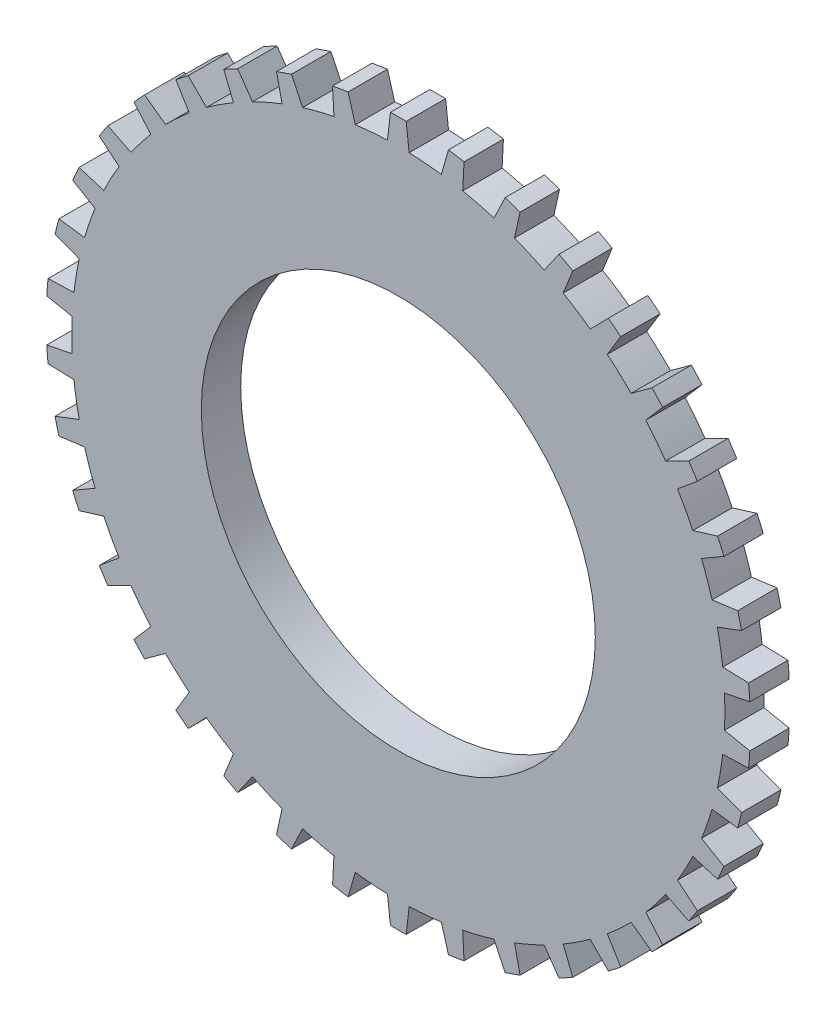
from build123d import *

# Parameters (mm, degrees)
CROQUIS1_R              = 10
SALIENTE_EXTRUIR1_DEPTH = 2


with BuildPart() as part:
    # Croquis1 → Saliente-Extruir1 (new body)
    with BuildSketch(Plane.XY):
        with BuildLine():
            Line((-0.4, 17.872007855), (-0.55, 16.567356684))
            ThreePointArc((-0.55, 16.567356684), (-1.368875163, 16.519866473), (-2.184398569, 16.431926557))
            Line((-2.184398569, 16.431926557), (-2.547091289, 17.694094798))
            Line((-2.547091289, 17.694094798), (-3.336180332, 17.562419126))
            Line((-3.336180332, 17.562419126), (-3.269396002, 16.250872508))
            ThreePointArc((-3.269396002, 16.250872508), (-4.069286144, 16.069247579), (-4.859212438, 15.848276309))
            Line((-4.859212438, 15.848276309), (-5.424704567, 17.033532961))
            Line((-5.424704567, 17.033532961), (-6.181358361, 16.773773385))
            Line((-6.181358361, 16.773773385), (-5.899611404, 15.491106893))
            ThreePointArc((-5.899611404, 15.491106893), (-6.658697606, 15.180301502), (-7.40147966, 14.832326396))
            Line((-7.40147966, 14.832326396), (-8.154346046, 15.908340747))
            ThreePointArc((-8.154346046, 15.908340747), (-8.508265751, 15.721898062), (-8.857925047, 15.527582833))
            Line((-8.857925047, 15.527582833), (-8.368900786, 14.308784264))
            ThreePointArc((-8.368900786, 14.308784264), (-9.066477156, 13.877276371), (-9.741853811, 13.411789285))
            Line((-9.741853811, 13.411789285), (-10.661558222, 14.349210468))
            ThreePointArc((-10.661558222, 14.349210468), (-10.979963466, 14.107057349), (-11.29287063, 13.857840297))
            Line((-11.29287063, 13.857840297), (-10.609908371, 12.736155301))
            ThreePointArc((-10.609908371, 12.736155301), (-11.226946843, 12.195715316), (-11.816495585, 11.625413523))
            Line((-11.816495585, 11.625413523), (-12.877950882, 12.398671132))
            ThreePointArc((-12.877950882, 12.398671132), (-13.1521564, 12.107412886), (-13.419776139, 11.810092004))
            Line((-13.419776139, 11.810092004), (-12.561505313, 10.816117222))
            ThreePointArc((-12.561505313, 10.816117222), (-13.081174687, 10.181486939), (-13.568814162, 9.521926786))
            Line((-13.568814162, 9.521926786), (-14.743066612, 10.109928369))
            ThreePointArc((-14.743066612, 10.109928369), (-14.965592793, 9.777509761), (-15.180625139, 9.440195187))
            Line((-15.180625139, 9.440195187), (-14.170457136, 8.60104366))
            ThreePointArc((-14.170457136, 8.60104366), (-14.578582186, 7.88953414), (-14.951010861, 7.158706708))
            Line((-14.951010861, 7.158706708), (-16.206029917, 7.545413115))
            ThreePointArc((-16.206029917, 7.545413115), (-16.370806826, 7.180901658), (-16.527386257, 6.812794454))
            Line((-16.527386257, 6.812794454), (-15.392875828, 6.151356049))
            ThreePointArc((-15.392875828, 6.151356049), (-15.678323966, 5.382375416), (-15.925382957, 4.600215772))
            Line((-15.925382957, 4.600215772), (-17.226934973, 4.775078661))
            ThreePointArc((-17.226934973, 4.775078661), (-17.329467925, 4.388417277), (-17.423323362, 3.999558448))
            Line((-17.423323362, 3.999558448), (-16.195416993, 3.53387548))
            ThreePointArc((-16.195416993, 3.53387548), (-16.350401938, 2.728399521), (-16.465352121, 1.916242942))
            Line((-16.465352121, 1.916242942), (-17.777934149, 1.874492508))
            ThreePointArc((-17.777934149, 1.874492508), (-17.815426314, 1.476228312), (-17.843997625, 1.077224914))
            Line((-17.843997625, 1.077224914), (-16.556189401, 0.82))
            ThreePointArc((-16.556189401, 0.82), (-16.576483568, 0), (-16.556189401, -0.82))
            Line((-16.556189401, -0.82), (-17.843997625, -1.077224914))
            ThreePointArc((-17.843997625, -1.077224914), (-17.815426314, -1.476228312), (-17.777934149, -1.874492508))
            Line((-17.777934149, -1.874492508), (-16.465352121, -1.916242942))
            ThreePointArc((-16.465352121, -1.916242942), (-16.350401938, -2.728399521), (-16.195416993, -3.53387548))
            Line((-16.195416993, -3.53387548), (-17.423323362, -3.999558448))
            ThreePointArc((-17.423323362, -3.999558448), (-17.329467925, -4.388417277), (-17.226934973, -4.775078661))
            Line((-17.226934973, -4.775078661), (-15.925382957, -4.600215772))
            ThreePointArc((-15.925382957, -4.600215772), (-15.678323966, -5.382375416), (-15.392875828, -6.151356049))
            Line((-15.392875828, -6.151356049), (-16.527386257, -6.812794454))
            ThreePointArc((-16.527386257, -6.812794454), (-16.370806826, -7.180901658), (-16.206029917, -7.545413115))
            Line((-16.206029917, -7.545413115), (-14.951010861, -7.158706708))
            ThreePointArc((-14.951010861, -7.158706708), (-14.578582186, -7.88953414), (-14.170457136, -8.60104366))
            Line((-14.170457136, -8.60104366), (-15.180625139, -9.440195187))
            ThreePointArc((-15.180625139, -9.440195187), (-14.965592793, -9.777509761), (-14.743066612, -10.109928369))
            Line((-14.743066612, -10.109928369), (-13.568814162, -9.521926786))
            ThreePointArc((-13.568814162, -9.521926786), (-13.081174687, -10.181486939), (-12.561505313, -10.816117222))
            Line((-12.561505313, -10.816117222), (-13.419776139, -11.810092004))
            ThreePointArc((-13.419776139, -11.810092004), (-13.1521564, -12.107412886), (-12.877950882, -12.398671132))
            Line((-12.877950882, -12.398671132), (-11.816495585, -11.625413523))
            ThreePointArc((-11.816495585, -11.625413523), (-11.226946843, -12.195715316), (-10.609908371, -12.736155301))
            Line((-10.609908371, -12.736155301), (-11.29287063, -13.857840297))
            ThreePointArc((-11.29287063, -13.857840297), (-10.979963466, -14.107057349), (-10.661558222, -14.349210468))
            Line((-10.661558222, -14.349210468), (-9.741853811, -13.411789285))
            ThreePointArc((-9.741853811, -13.411789285), (-9.066477156, -13.877276371), (-8.368900786, -14.308784264))
            Line((-8.368900786, -14.308784264), (-8.857925047, -15.527582833))
            ThreePointArc((-8.857925047, -15.527582833), (-8.508265751, -15.721898062), (-8.154346046, -15.908340747))
            Line((-8.154346046, -15.908340747), (-7.40147966, -14.832326396))
            ThreePointArc((-7.40147966, -14.832326396), (-6.658697606, -15.180301502), (-5.899611404, -15.491106893))
            Line((-5.899611404, -15.491106893), (-6.181358361, -16.773773385))
            ThreePointArc((-6.181358361, -16.773773385), (-5.804484726, -16.90788638), (-5.424704567, -17.033532961))
            Line((-5.424704567, -17.033532961), (-4.859212438, -15.848276309))
            ThreePointArc((-4.859212438, -15.848276309), (-4.069286144, -16.069247579), (-3.269396002, -16.250872508))
            Line((-3.269396002, -16.250872508), (-3.336180332, -17.562419126))
            ThreePointArc((-3.336180332, -17.562419126), (-2.942372489, -17.632671633), (-2.547091289, -17.694094798))
            Line((-2.547091289, -17.694094798), (-2.184398569, -16.431926557))
            ThreePointArc((-2.184398569, -16.431926557), (-1.368875163, -16.519866473), (-0.55, -16.567356684))
            Line((-0.55, -16.567356684), (-0.4, -17.872007855))
            ThreePointArc((-0.4, -17.872007855), (0, -17.876483568), (0.4, -17.872007855))
            Line((0.4, -17.872007855), (0.55, -16.567356684))
            ThreePointArc((0.55, -16.567356684), (1.368875163, -16.519866473), (2.184398569, -16.431926557))
            Line((2.184398569, -16.431926557), (2.547091289, -17.694094798))
            ThreePointArc((2.547091289, -17.694094798), (2.942372489, -17.632671633), (3.336180332, -17.562419126))
            Line((3.336180332, -17.562419126), (3.269396002, -16.250872508))
            ThreePointArc((3.269396002, -16.250872508), (4.069286144, -16.069247579), (4.859212438, -15.848276309))
            Line((4.859212438, -15.848276309), (5.424704567, -17.033532961))
            ThreePointArc((5.424704567, -17.033532961), (5.804484726, -16.90788638), (6.181358361, -16.773773385))
            Line((6.181358361, -16.773773385), (5.899611404, -15.491106893))
            ThreePointArc((5.899611404, -15.491106893), (6.658697606, -15.180301502), (7.40147966, -14.832326396))
            Line((7.40147966, -14.832326396), (8.154346046, -15.908340747))
            ThreePointArc((8.154346046, -15.908340747), (8.508265751, -15.721898062), (8.857925047, -15.527582833))
            Line((8.857925047, -15.527582833), (8.368900786, -14.308784264))
            ThreePointArc((8.368900786, -14.308784264), (9.066477156, -13.877276371), (9.741853811, -13.411789285))
            Line((9.741853811, -13.411789285), (10.661558222, -14.349210468))
            ThreePointArc((10.661558222, -14.349210468), (10.979963466, -14.107057349), (11.29287063, -13.857840297))
            Line((11.29287063, -13.857840297), (10.609908371, -12.736155301))
            ThreePointArc((10.609908371, -12.736155301), (11.226946843, -12.195715316), (11.816495585, -11.625413523))
            Line((11.816495585, -11.625413523), (12.877950882, -12.398671132))
            ThreePointArc((12.877950882, -12.398671132), (13.1521564, -12.107412886), (13.419776139, -11.810092004))
            Line((13.419776139, -11.810092004), (12.561505313, -10.816117222))
            ThreePointArc((12.561505313, -10.816117222), (13.081174687, -10.181486939), (13.568814162, -9.521926786))
            Line((13.568814162, -9.521926786), (14.743066612, -10.109928369))
            ThreePointArc((14.743066612, -10.109928369), (14.965592793, -9.777509761), (15.180625139, -9.440195187))
            Line((15.180625139, -9.440195187), (14.170457136, -8.60104366))
            ThreePointArc((14.170457136, -8.60104366), (14.578582186, -7.88953414), (14.951010861, -7.158706708))
            Line((14.951010861, -7.158706708), (16.206029917, -7.545413115))
            ThreePointArc((16.206029917, -7.545413115), (16.370806826, -7.180901658), (16.527386257, -6.812794454))
            Line((16.527386257, -6.812794454), (15.392875828, -6.151356049))
            ThreePointArc((15.392875828, -6.151356049), (15.678323966, -5.382375416), (15.925382957, -4.600215772))
            Line((15.925382957, -4.600215772), (17.226934973, -4.775078661))
            ThreePointArc((17.226934973, -4.775078661), (17.329467925, -4.388417277), (17.423323362, -3.999558448))
            Line((17.423323362, -3.999558448), (16.195416993, -3.53387548))
            ThreePointArc((16.195416993, -3.53387548), (16.350401938, -2.728399521), (16.465352121, -1.916242942))
            Line((16.465352121, -1.916242942), (17.777934149, -1.874492508))
            ThreePointArc((17.777934149, -1.874492508), (17.815426314, -1.476228312), (17.843997625, -1.077224914))
            Line((17.843997625, -1.077224914), (16.556189401, -0.82))
            ThreePointArc((16.556189401, -0.82), (16.576483568, 0), (16.556189401, 0.82))
            Line((16.556189401, 0.82), (17.843997625, 1.077224914))
            ThreePointArc((17.843997625, 1.077224914), (17.815426314, 1.476228312), (17.777934149, 1.874492508))
            Line((17.777934149, 1.874492508), (16.465352121, 1.916242942))
            ThreePointArc((16.465352121, 1.916242942), (16.350401938, 2.728399521), (16.195416993, 3.53387548))
            Line((16.195416993, 3.53387548), (17.423323362, 3.999558448))
            ThreePointArc((17.423323362, 3.999558448), (17.329467925, 4.388417277), (17.226934973, 4.775078661))
            Line((17.226934973, 4.775078661), (15.925382957, 4.600215772))
            ThreePointArc((15.925382957, 4.600215772), (15.678323966, 5.382375416), (15.392875828, 6.151356049))
            Line((15.392875828, 6.151356049), (16.527386257, 6.812794454))
            ThreePointArc((16.527386257, 6.812794454), (16.370806826, 7.180901658), (16.206029917, 7.545413115))
            Line((16.206029917, 7.545413115), (14.951010861, 7.158706708))
            ThreePointArc((14.951010861, 7.158706708), (14.578582186, 7.88953414), (14.170457136, 8.60104366))
            Line((14.170457136, 8.60104366), (15.180625139, 9.440195187))
            ThreePointArc((15.180625139, 9.440195187), (14.965592793, 9.777509761), (14.743066612, 10.109928369))
            Line((14.743066612, 10.109928369), (13.568814162, 9.521926786))
            ThreePointArc((13.568814162, 9.521926786), (13.081174687, 10.181486939), (12.561505313, 10.816117222))
            Line((12.561505313, 10.816117222), (13.419776139, 11.810092004))
            ThreePointArc((13.419776139, 11.810092004), (13.1521564, 12.107412886), (12.877950882, 12.398671132))
            Line((12.877950882, 12.398671132), (11.816495585, 11.625413523))
            ThreePointArc((11.816495585, 11.625413523), (11.226946843, 12.195715316), (10.609908371, 12.736155301))
            Line((10.609908371, 12.736155301), (11.29287063, 13.857840297))
            ThreePointArc((11.29287063, 13.857840297), (10.979963466, 14.107057349), (10.661558222, 14.349210468))
            Line((10.661558222, 14.349210468), (9.741853811, 13.411789285))
            ThreePointArc((9.741853811, 13.411789285), (9.066477156, 13.877276371), (8.368900786, 14.308784264))
            Line((8.368900786, 14.308784264), (8.857925047, 15.527582833))
            ThreePointArc((8.857925047, 15.527582833), (8.508265751, 15.721898062), (8.154346046, 15.908340747))
            Line((8.154346046, 15.908340747), (7.40147966, 14.832326396))
            ThreePointArc((7.40147966, 14.832326396), (6.658697606, 15.180301502), (5.899611404, 15.491106893))
            Line((5.899611404, 15.491106893), (6.181358361, 16.773773385))
            ThreePointArc((6.181358361, 16.773773385), (5.804484726, 16.90788638), (5.424704567, 17.033532961))
            Line((5.424704567, 17.033532961), (4.859212438, 15.848276309))
            ThreePointArc((4.859212438, 15.848276309), (4.069286144, 16.069247579), (3.269396002, 16.250872508))
            Line((3.269396002, 16.250872508), (3.336180332, 17.562419126))
            ThreePointArc((3.336180332, 17.562419126), (2.942372489, 17.632671633), (2.547091289, 17.694094798))
            Line((2.547091289, 17.694094798), (2.184398569, 16.431926557))
            ThreePointArc((2.184398569, 16.431926557), (1.368875163, 16.519866473), (0.55, 16.567356684))
            Line((0.55, 16.567356684), (0.4, 17.872007855))
            ThreePointArc((0.4, 17.872007855), (0, 17.876483568), (-0.4, 17.872007855))
        make_face()
        Circle(CROQUIS1_R, mode=Mode.SUBTRACT)
    extrude(amount=SALIENTE_EXTRUIR1_DEPTH)


solid = part.part
